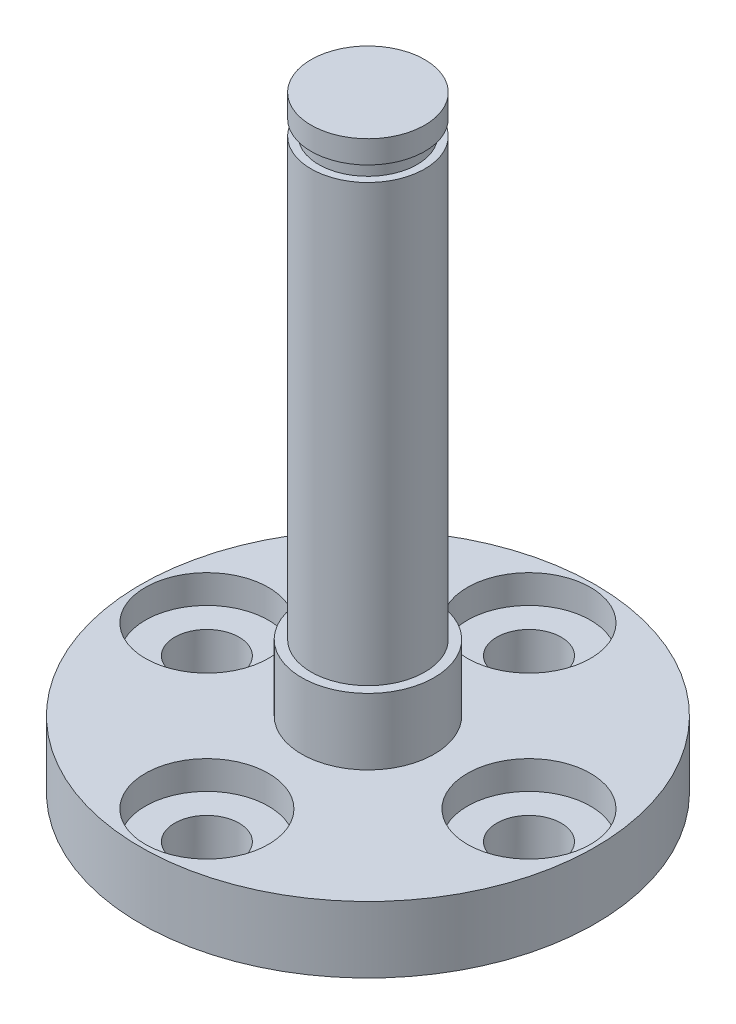
from build123d import *

# Parameters (mm, degrees)
SKETCH_2_R                   = 12
EXTRUDE_1_DEPTH              = 3.5
SKETCH_3_R                   = 2.95
EXTRUDE_2_DEPTH              = 2
HOLE_WIZARD_M3_1_D           = 3.4
HOLE_WIZARD_M3_1_CBORE_D     = 6.5
HOLE_WIZARD_M3_1_CBORE_DEPTH = 1.5
PATTERN_CIRCULAR_1_COUNT     = 4


with BuildPart() as part:
    # 草图1 → 旋转1 (revolve)
    with BuildSketch(Plane.XY, mode=Mode.PRIVATE) as revolve_1_sk:
        Polygon((3, 27.3), (3, 28.5), (0, 28.5), (0, 0), (3.5, 0), (3.5, 3.5), (3, 3.5), (3, 26.5), (2.6, 26.5), (2.6, 27.3), align=None)
    revolve(revolve_1_sk.sketch.rotate(Axis((0, 0, 0), (0, 1, 0)), 90), axis=Axis((0, 0, 0), (0, 1, 0)))

    # 草图2 → 凸台-拉伸1 (add)
    with BuildSketch(Plane.XZ):
        with Locations(Location((0, 0, 0), (0, 0, 270))):
            Circle(SKETCH_2_R)
    extrude(amount=EXTRUDE_1_DEPTH)

    # 草图3 → 凸台-拉伸2 (add)
    with BuildSketch(Plane.XZ.offset(3.5)):
        with Locations(Location((0, 0, 0), (0, 0, 270))):
            Circle(SKETCH_3_R)
    extrude(amount=EXTRUDE_2_DEPTH)

    # M3 六角凹头螺钉的柱形沉头孔1 (through all)
    with Locations(Plane(origin=(0, 0, 0), x_dir=(1, 0, 0), z_dir=(0, 1, 0))):
        with Locations((8.5, 0)):
            hole_wizard_m3_1 = CounterBoreHole(HOLE_WIZARD_M3_1_D / 2, HOLE_WIZARD_M3_1_CBORE_D / 2, HOLE_WIZARD_M3_1_CBORE_DEPTH)

    # 阵列(圆周)1: M3 六角凹头螺钉的柱形沉头孔1 ×4 about axis
    pattern_circular_1_axis = Axis((0, 0, 0), (0, 1, 0))
    for i in range(1, PATTERN_CIRCULAR_1_COUNT):
        add(hole_wizard_m3_1.rotate(pattern_circular_1_axis, i * 360 / PATTERN_CIRCULAR_1_COUNT), mode=Mode.SUBTRACT)


solid = part.part
